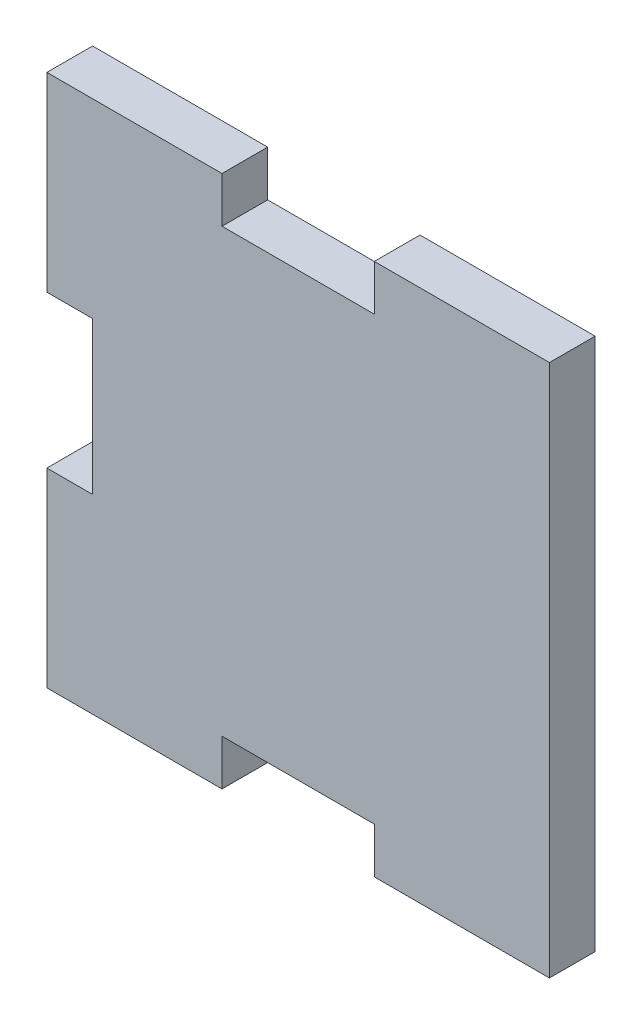
from build123d import *

# Parameters (mm, degrees)
RESSALTO_EXTRUS_O1_DEPTH = 3


with BuildPart() as part:
    # Esboço1 → Ressalto-extrusão1 (new body)
    with BuildSketch(Plane.XY):
        Polygon((-16.5, -5), (-16.5, -17.5), (-5, -17.5), (-5, -14.5), (5, -14.5), (5, -17.5), (16.5, -17.5), (16.5, 17.5), (5, 17.5), (5, 14.5), (-5, 14.5), (-5, 17.5), (-16.5, 17.5), (-16.5, 5), (-13.5, 5), (-13.5, -5), align=None)
    extrude(amount=RESSALTO_EXTRUS_O1_DEPTH)


solid = part.part
